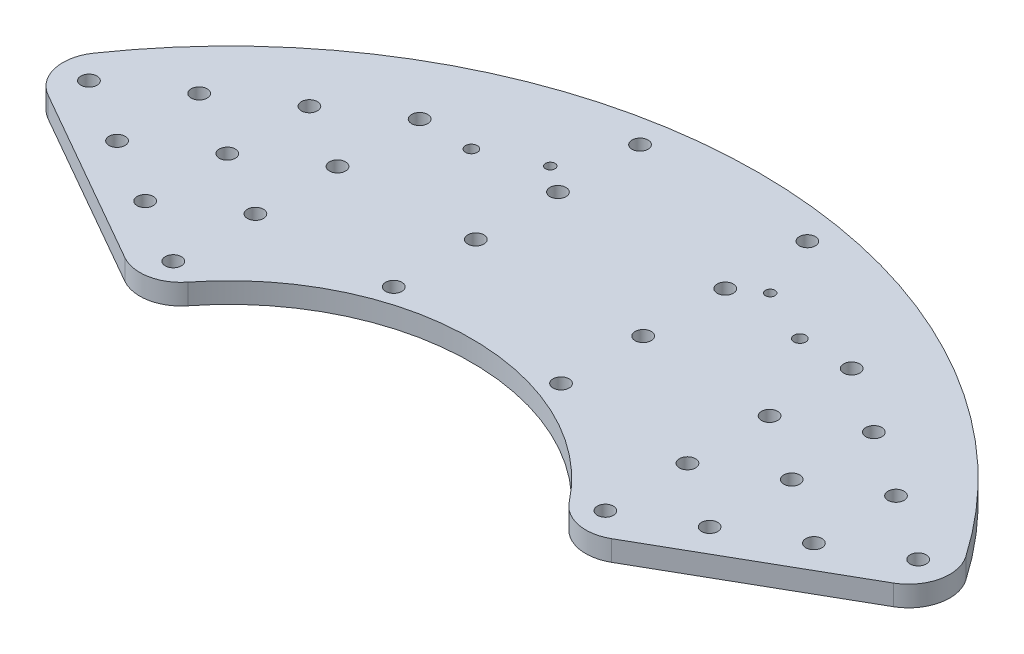
from build123d import *

# Parameters (mm, degrees)
BOSS_EXTRUDE1_DEPTH       = 6.35
F_6_CLEARANCE_HOLE1_D     = 3.6576
F_6_CLEARANCE_HOLE1_DEPTH = 25.4
F_6_CLEARANCE_HOLE1_TIP   = 1.0988539
FILLET1_R                 = 12.7
F_4_CLEARANCE_HOLE1_D     = 2.9464
F_4_CLEARANCE_HOLE1_DEPTH = 25.4
F_4_CLEARANCE_HOLE1_TIP   = 0.885187864
LPATTERN4_COUNT           = 6
LPATTERN4_PITCH           = 25.4
LPATTERN4_COUNT_DIR2      = 7
LPATTERN4_PITCH_DIR2      = 23.622


with BuildPart() as part:
    # Sketch1 → Boss-Extrude1 (new body)
    with BuildSketch(Plane(origin=(0, 0, 0), x_dir=(1, 0, 0), z_dir=(0, 1, 0))):
        with BuildLine():
            Line((65.058096917, 37.174573643), (142.24566953, 81.28))
            ThreePointArc((142.24566953, 81.28), (0, 163.83), (-142.24566953, 81.28))
            Line((-142.24566953, 81.28), (-65.058096917, 37.174573643))
            ThreePointArc((-65.058096917, 37.174573643), (0, 74.93), (65.058096917, 37.174573643))
        make_face()
    extrude(amount=BOSS_EXTRUDE1_DEPTH)

    # #6 Clearance Hole1
    with Locations(Plane(origin=(-50.8, 6.35, -125.73), x_dir=(0, 0, 1), z_dir=(0, 1, 0))):
        with Locations((0, 0), (0, 101.6)):
            Hole(F_6_CLEARANCE_HOLE1_D / 2, depth=F_6_CLEARANCE_HOLE1_DEPTH)
            with Locations((0, 0, -(F_6_CLEARANCE_HOLE1_DEPTH + F_6_CLEARANCE_HOLE1_TIP / 2))):  # 118° drill point
                Cone(0, F_6_CLEARANCE_HOLE1_D / 2, F_6_CLEARANCE_HOLE1_TIP, mode=Mode.SUBTRACT)

    # Fillet1
    fillet1_edges = [part.edges().sort_by_distance(p)[0] for p in [
        (65.058096917, 3.175, -37.174573643),
        (-142.24566953, 3.175, -81.28),
        (-65.058096917, 3.175, -37.174573643),
        (142.24566953, 3.175, -81.28),
    ]]
    fillet(fillet1_edges, radius=FILLET1_R)

    # #4 Clearance Hole1
    with Locations(Plane(origin=(0, 6.35, 0), x_dir=(-1, 0, 0), z_dir=(0, 1, 0))):
        with Locations((-34.0106, -133.35), (34.0106, -133.35)):
            Hole(F_4_CLEARANCE_HOLE1_D / 2, depth=F_4_CLEARANCE_HOLE1_DEPTH)
            with Locations((0, 0, -(F_4_CLEARANCE_HOLE1_DEPTH + F_4_CLEARANCE_HOLE1_TIP / 2))):  # 118° drill point
                Cone(0, F_4_CLEARANCE_HOLE1_D / 2, F_4_CLEARANCE_HOLE1_TIP, mode=Mode.SUBTRACT)

    # Sketch5 → #10 Clearance Hole1 (revolve, cut)
    with BuildSketch(Plane(origin=(-128.255094273, 6.35, -84.874017323), x_dir=(0, 0, 1), z_dir=(1, 0, 0))):
        Polygon((0, 0), (0, 26.895662253), (2.4892, 25.4), (2.4892, 0), align=None)
    f_10_clearance_hole1 = revolve(axis=Axis((-128.255094273, 12.7, -84.874017323), (0, -1, 0)), mode=Mode.SUBTRACT)

    # LPattern4: 10 Clearance Hole1 6 × 7, 28 skipped
    with Locations(*[Vector(0, 0, -1) * (i * LPATTERN4_PITCH) + Vector(0.8667949394357127, 0, 0.49866475007628047) * (j * LPATTERN4_PITCH_DIR2) for i in range(LPATTERN4_COUNT) for j in range(LPATTERN4_COUNT_DIR2) if (i, j) not in ((0, 0), (0, 4), (0, 5), (0, 6), (1, 0), (1, 4), (1, 5), (1, 6), (2, 0), (2, 1), (2, 4), (2, 6), (3, 0), (3, 1), (3, 2), (3, 4), (3, 6), (4, 0), (4, 1), (4, 2), (4, 3), (4, 4), (4, 6), (5, 0), (5, 1), (5, 2), (5, 3), (5, 4), (5, 6))]):
        add(f_10_clearance_hole1, mode=Mode.SUBTRACT)

    # Mirror4 copy 1 sketch → Mirror4 copy 1 (revolve, cut)
    with BuildSketch(Plane(origin=(107.779664214, 6.35, -73.094558596), x_dir=(0, 0, 1), z_dir=(-1, 0, 0))):
        Polygon((0, 0), (0, -26.895662253), (2.4892, -25.4), (2.4892, 0), align=None)
    revolve(axis=Axis((107.779664214, 12.7, -73.094558596), (0, 1, 0)), mode=Mode.SUBTRACT)

    # Mirror4 copy 2 sketch → Mirror4 copy 2 (revolve, cut)
    with BuildSketch(Plane(origin=(87.304234155, 6.35, -61.31509987), x_dir=(0, 0, 1), z_dir=(-1, 0, 0))):
        Polygon((0, 0), (0, -26.895662253), (2.4892, -25.4), (2.4892, 0), align=None)
    revolve(axis=Axis((87.304234155, 12.7, -61.31509987), (0, 1, 0)), mode=Mode.SUBTRACT)

    # Mirror4 copy 3 sketch → Mirror4 copy 3 (revolve, cut)
    with BuildSketch(Plane(origin=(66.828804095, 6.35, -49.535641144), x_dir=(0, 0, 1), z_dir=(-1, 0, 0))):
        Polygon((0, 0), (0, -26.895662253), (2.4892, -25.4), (2.4892, 0), align=None)
    revolve(axis=Axis((66.828804095, 12.7, -49.535641144), (0, 1, 0)), mode=Mode.SUBTRACT)

    # Mirror4 copy 4 sketch → Mirror4 copy 4 (revolve, cut)
    with BuildSketch(Plane(origin=(107.779664214, 6.35, -98.494558596), x_dir=(0, 0, 1), z_dir=(-1, 0, 0))):
        Polygon((0, 0), (0, -26.895662253), (2.4892, -25.4), (2.4892, 0), align=None)
    revolve(axis=Axis((107.779664214, 12.7, -98.494558596), (0, 1, 0)), mode=Mode.SUBTRACT)

    # Mirror4 copy 5 sketch → Mirror4 copy 5 (revolve, cut)
    with BuildSketch(Plane(origin=(87.304234155, 6.35, -86.71509987), x_dir=(0, 0, 1), z_dir=(-1, 0, 0))):
        Polygon((0, 0), (0, -26.895662253), (2.4892, -25.4), (2.4892, 0), align=None)
    revolve(axis=Axis((87.304234155, 12.7, -86.71509987), (0, 1, 0)), mode=Mode.SUBTRACT)

    # Mirror4 copy 6 sketch → Mirror4 copy 6 (revolve, cut)
    with BuildSketch(Plane(origin=(66.828804095, 6.35, -74.935641144), x_dir=(0, 0, 1), z_dir=(-1, 0, 0))):
        Polygon((0, 0), (0, -26.895662253), (2.4892, -25.4), (2.4892, 0), align=None)
    revolve(axis=Axis((66.828804095, 12.7, -74.935641144), (0, 1, 0)), mode=Mode.SUBTRACT)

    # Mirror4 copy 7 sketch → Mirror4 copy 7 (revolve, cut)
    with BuildSketch(Plane(origin=(87.304234155, 6.35, -112.11509987), x_dir=(0, 0, 1), z_dir=(-1, 0, 0))):
        Polygon((0, 0), (0, -26.895662253), (2.4892, -25.4), (2.4892, 0), align=None)
    revolve(axis=Axis((87.304234155, 12.7, -112.11509987), (0, 1, 0)), mode=Mode.SUBTRACT)

    # Mirror4 copy 8 sketch → Mirror4 copy 8 (revolve, cut)
    with BuildSketch(Plane(origin=(66.828804095, 6.35, -100.335641144), x_dir=(0, 0, 1), z_dir=(-1, 0, 0))):
        Polygon((0, 0), (0, -26.895662253), (2.4892, -25.4), (2.4892, 0), align=None)
    revolve(axis=Axis((66.828804095, 12.7, -100.335641144), (0, 1, 0)), mode=Mode.SUBTRACT)

    # Mirror4 copy 9 sketch → Mirror4 copy 9 (revolve, cut)
    with BuildSketch(Plane(origin=(25.877943977, 6.35, -76.776723691), x_dir=(0, 0, 1), z_dir=(-1, 0, 0))):
        Polygon((0, 0), (0, -26.895662253), (2.4892, -25.4), (2.4892, 0), align=None)
    revolve(axis=Axis((25.877943977, 12.7, -76.776723691), (0, 1, 0)), mode=Mode.SUBTRACT)

    # Mirror4 copy 10 sketch → Mirror4 copy 10 (revolve, cut)
    with BuildSketch(Plane(origin=(66.828804095, 6.35, -125.735641144), x_dir=(0, 0, 1), z_dir=(-1, 0, 0))):
        Polygon((0, 0), (0, -26.895662253), (2.4892, -25.4), (2.4892, 0), align=None)
    revolve(axis=Axis((66.828804095, 12.7, -125.735641144), (0, 1, 0)), mode=Mode.SUBTRACT)

    # Mirror4 copy 11 sketch → Mirror4 copy 11 (revolve, cut)
    with BuildSketch(Plane(origin=(25.877943977, 6.35, -102.176723691), x_dir=(0, 0, 1), z_dir=(-1, 0, 0))):
        Polygon((0, 0), (0, -26.895662253), (2.4892, -25.4), (2.4892, 0), align=None)
    revolve(axis=Axis((25.877943977, 12.7, -102.176723691), (0, 1, 0)), mode=Mode.SUBTRACT)

    # Mirror4 copy 12 sketch → Mirror4 copy 12 (revolve, cut)
    with BuildSketch(Plane(origin=(25.877943977, 6.35, -127.576723691), x_dir=(0, 0, 1), z_dir=(-1, 0, 0))):
        Polygon((0, 0), (0, -26.895662253), (2.4892, -25.4), (2.4892, 0), align=None)
    revolve(axis=Axis((25.877943977, 12.7, -127.576723691), (0, 1, 0)), mode=Mode.SUBTRACT)

    # Mirror4 copy 13 sketch → Mirror4 copy 13 (revolve, cut)
    with BuildSketch(Plane(origin=(25.877943977, 6.35, -152.976723691), x_dir=(0, 0, 1), z_dir=(-1, 0, 0))):
        Polygon((0, 0), (0, -26.895662253), (2.4892, -25.4), (2.4892, 0), align=None)
    revolve(axis=Axis((25.877943977, 12.7, -152.976723691), (0, 1, 0)), mode=Mode.SUBTRACT)

    # Mirror4 copy 14 sketch → Mirror4 copy 14 (revolve, cut)
    with BuildSketch(Plane(origin=(128.255094273, 6.35, -84.874017323), x_dir=(0, 0, 1), z_dir=(-1, 0, 0))):
        Polygon((0, 0), (0, -26.895662253), (2.4892, -25.4), (2.4892, 0), align=None)
    revolve(axis=Axis((128.255094273, 12.7, -84.874017323), (0, 1, 0)), mode=Mode.SUBTRACT)


solid = part.part
